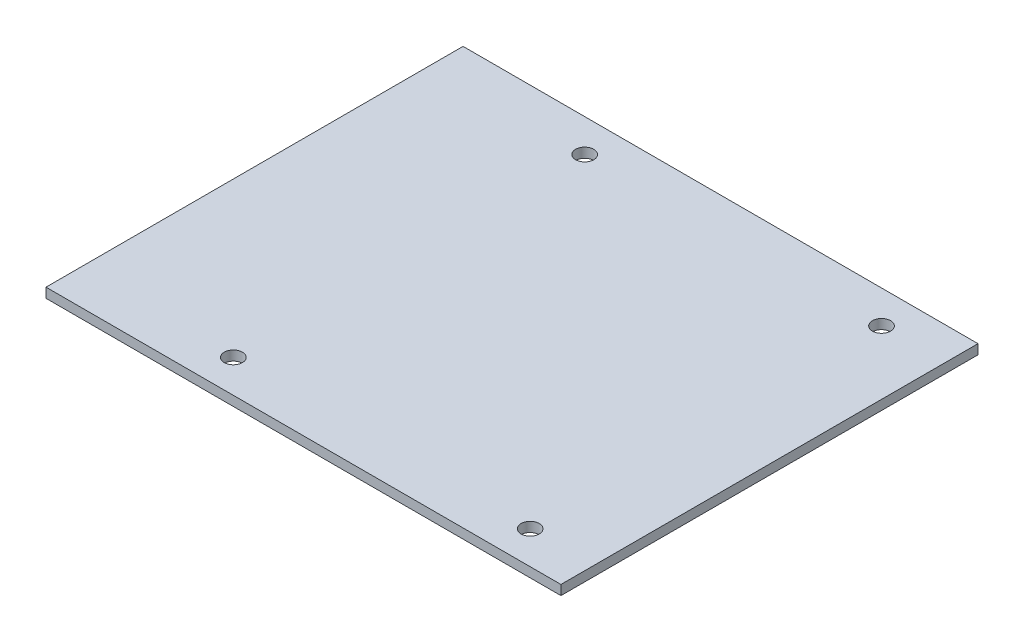
from build123d import *

# Parameters (mm, degrees)
CROQUIS1_W              = 85
CROQUIS1_H              = 68.845605015
CROQUIS1_R              = 1.5
SALIENTE_EXTRUIR1_DEPTH = 1.6


with BuildPart() as part:
    # Croquis1 → Saliente-Extruir1 (new body)
    with BuildSketch(Plane(origin=(0, 0, 0), x_dir=(1, 0, 0), z_dir=(0, 1, 0))):
        with Locations((-7.5, -15.577197492)):
            Rectangle(CROQUIS1_W, CROQUIS1_H)
        with Locations(Location((-24.5, 13.422802508, 0), (0, 0, 270))):
            Circle(CROQUIS1_R, mode=Mode.SUBTRACT)
        with Locations(Location((24.5, 13.422802508, 0), (0, 0, 270))):
            Circle(CROQUIS1_R, mode=Mode.SUBTRACT)
        with Locations(Location((-24.5, -44.577197492, 0), (0, 0, 270))):
            Circle(CROQUIS1_R, mode=Mode.SUBTRACT)
        with Locations(Location((24.5, -44.577197492, 0), (0, 0, 270))):
            Circle(CROQUIS1_R, mode=Mode.SUBTRACT)
    extrude(amount=SALIENTE_EXTRUIR1_DEPTH)


solid = part.part
